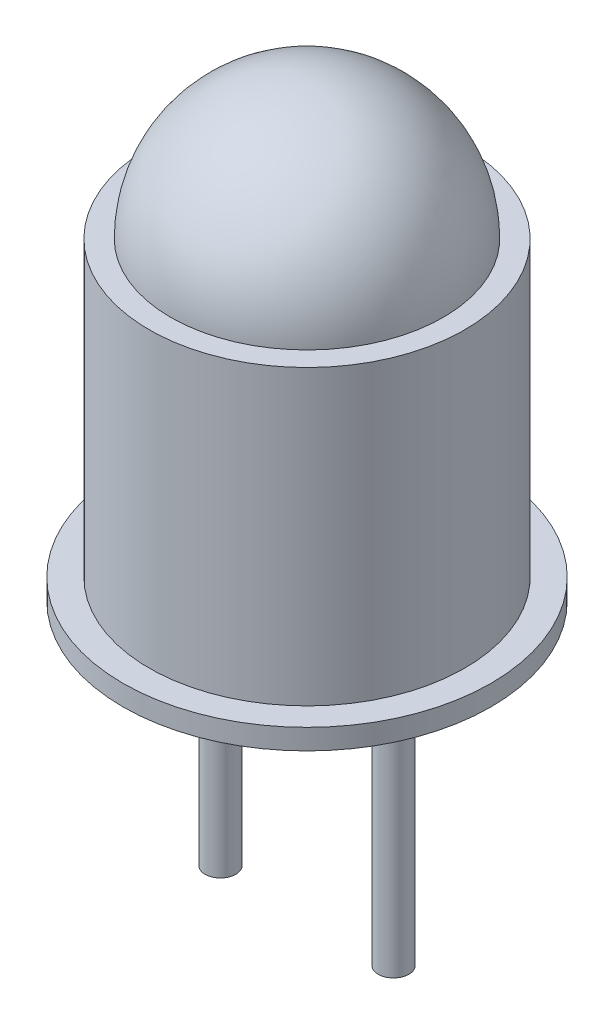
from build123d import *

# Parameters (mm, degrees)
SKETCH_1_R      = 2.315
EXTRUDE_1_DEPTH = 4.3
SKETCH_3_R      = 2.7
EXTRUDE_2_DEPTH = 0.3
SKETCH_5_R      = 0.225
EXTRUDE_3_DEPTH = 4


with BuildPart() as part:
    # 草图1 → 凸台-拉伸1 (new body)
    with BuildSketch(Plane(origin=(0, 0, 0), x_dir=(1, 0, 0), z_dir=(0, 1, 0))):
        with Locations(Location((0, 0, 0), (0, 0, 90))):
            Circle(SKETCH_1_R)
    extrude(amount=EXTRUDE_1_DEPTH)

    # 草图2 → 旋转2 (revolve)
    with BuildSketch(Plane.XY):
        with BuildLine():
            Line((-2, 4.3), (0, 4.3))
            Line((0, 4.3), (0, 6.3))
            ThreePointArc((0, 6.3), (-1.414213562, 5.714213562), (-2, 4.3))
        make_face()
    revolve(axis=Axis((0, 11.522957205, 0), (0, -1, 0)))

    # 草图3 → 凸台-拉伸2 (add)
    with BuildSketch(Plane.XZ):
        with Locations(Location((0, 0, 0), (0, 0, 270))):
            Circle(SKETCH_3_R)
    extrude(amount=EXTRUDE_2_DEPTH)

    # 草图5 → 凸台-拉伸3 (add)
    with BuildSketch(Plane.XZ.offset(0.3)):
        with Locations(Location((-1.27, 0, 0), (0, 0, 270))):
            Circle(SKETCH_5_R)
        with Locations(Location((1.27, 0, 0), (0, 0, 270))):
            Circle(SKETCH_5_R)
        with Locations(Location((0, -1.27, 0), (0, 0, 270))):
            Circle(SKETCH_5_R)
    extrude(amount=EXTRUDE_3_DEPTH)


solid = part.part
